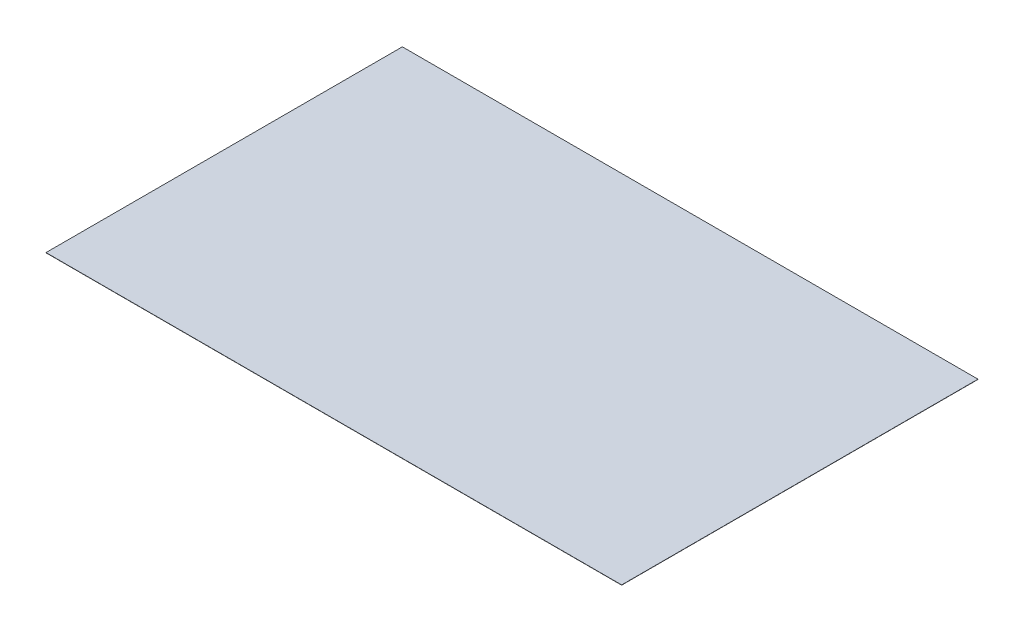
from build123d import *

# Parameters (mm, degrees)
SKETCH1_W           = 128016
SKETCH1_H           = 79248
BOSS_EXTRUDE1_DEPTH = 50.8


with BuildPart() as part:
    # Sketch1 → Boss-Extrude1 (new body)
    with BuildSketch(Plane(origin=(0, 0, 0), x_dir=(1, 0, 0), z_dir=(0, 1, 0))):
        Rectangle(SKETCH1_W, SKETCH1_H)
    extrude(amount=BOSS_EXTRUDE1_DEPTH)


solid = part.part
